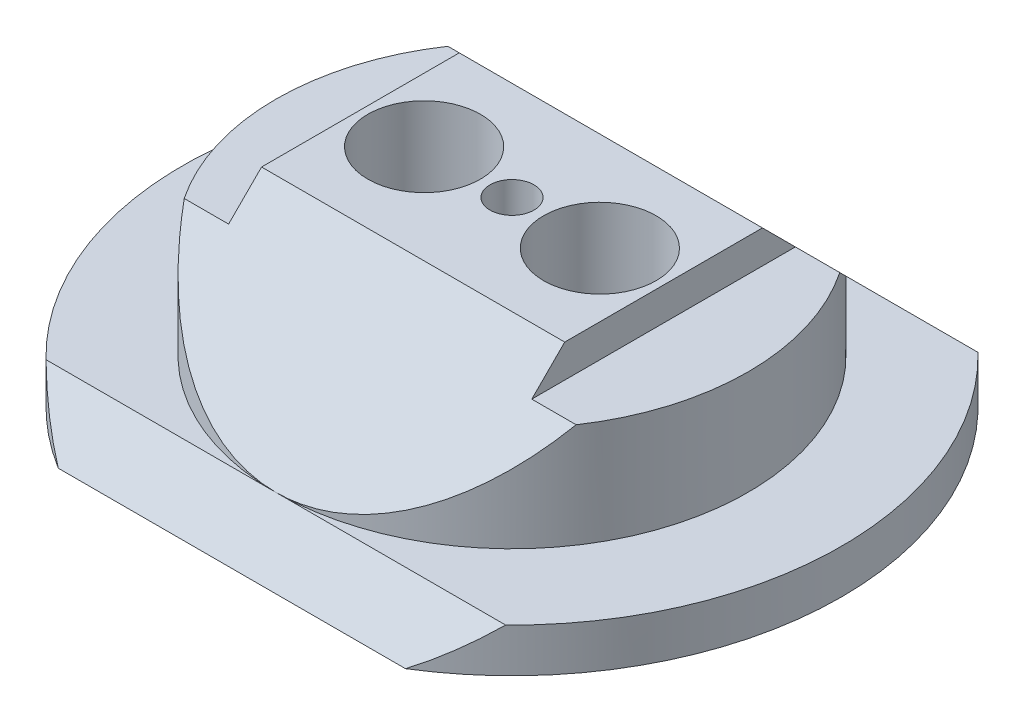
from build123d import *
from build123d.topology import SkipClean

# Parameters (mm, degrees)
SKETCH1_R                            = 30
BOSS_EXTRUDE1_DEPTH                  = 4
BOSS_EXTRUDE2_REACH                  = 44.615
BOSS_EXTRUDE2_END_RADIUS             = 30
BOSS_EXTRUDE2_DIRECTION_2_REACH      = 44.615
BOSS_EXTRUDE2_DIRECTION_2_END_RADIUS = 30
SKETCH3_OUTSIDE_W                    = 78.092
SKETCH3_OUTSIDE_H                    = 69.092
SKETCH3_OUTSIDE_R                    = 21.5
CUT_EXTRUDE2_DEPTH                   = 12.5
BOSS_EXTRUDE3_DEPTH                  = 18
BOSS_EXTRUDE4_DEPTH                  = 15
BOSS_EXTRUDE5_DEPTH                  = 15
CUT_EXTRUDE3_DEPTH                   = 44.292609069
CUT_EXTRUDE3_DEPTH_BACK              = 44.292609069
SKETCH8_R                            = 2
CUT_EXTRUDE8_DEPTH                   = 48.077064479
CUT_EXTRUDE8_DEPTH_BACK              = 48.077064479
CUT_EXTRUDE9_DEPTH                   = 59.659818207
CUT_EXTRUDE11_DEPTH                  = 20
CUT_EXTRUDE12_DEPTH                  = 20
CUT_EXTRUDE13_DEPTH                  = 20
CUT_EXTRUDE14_DEPTH                  = 44.292609069
CUT_EXTRUDE14_DEPTH_BACK             = 44.292609069
SKETCH25_W                           = 66.075437062
SKETCH25_H                           = 20.142243048
SKETCH26_R                           = 5.125
CUT_EXTRUDE15_DEPTH                  = 24
CUT_EXTRUDE17_DEPTH                  = 47.524187258
CUT_EXTRUDE17_DEPTH_BACK             = 47.524187258
SKETCH29_W                           = 7.7
SKETCH29_H                           = 3
CUT_EXTRUDE18_DEPTH                  = 47.524187258
CUT_EXTRUDE18_DEPTH_BACK             = 47.524187258
SKETCH31_W                           = 7.7
SKETCH31_H                           = 3
SKETCH34_R                           = 1.375
CUT_EXTRUDE21_DEPTH                  = 20
SKETCH35_R                           = 2
CUT_EXTRUDE22_DEPTH                  = 6
SKETCH37_R                           = 5
CUT_EXTRUDE23_DEPTH                  = 3


with BuildPart() as part:
    # Sketch1 → Boss-Extrude1 (new body)
    with BuildSketch(Plane(origin=(0, 0, 0), x_dir=(1, 0, 0), z_dir=(0, 1, 0))):
        with Locations(Location((0, 0, 0), (0, 0, 270))):
            Circle(SKETCH1_R)
    extrude(amount=BOSS_EXTRUDE1_DEPTH)

    # Boss-Extrude2: up to this cylinder (the profile starts inside it)
    with SkipClean():  # the faces are left unmerged after this step: merging them gives an invalid solid
        boss_extrude2_end = Plane(origin=(0, 9.396175, 0), z_dir=(0, -1, 0)) * Cylinder(BOSS_EXTRUDE2_END_RADIUS, 150.23, mode=Mode.PRIVATE)
        # Sketch2 → Boss-Extrude2 (add, up to the surface)
        with BuildSketch(Plane(origin=(0, 0, 0), x_dir=(0, 0, -1), z_dir=(1, 0, 0)), mode=Mode.PRIVATE) as boss_extrude2_sk1:
            Polygon((0, 4), (21.5, 4), (9, 16.5), (-9, 16.5), (-21.5, 4), align=None)
        boss_extrude2_tool1 = extrude(boss_extrude2_sk1.sketch, amount=BOSS_EXTRUDE2_REACH, mode=Mode.PRIVATE) & boss_extrude2_end
        add(boss_extrude2_tool1.solids().sort_by_distance((0, 9.396175, 0))[0])

    # Boss-Extrude2 direction 2: up to this cylinder (the profile starts inside it)
    with SkipClean():  # the faces are left unmerged after this step: merging them gives an invalid solid
        boss_extrude2_direction_2_end = Plane(origin=(0, 9.396175, 0), z_dir=(0, -1, 0)) * Cylinder(BOSS_EXTRUDE2_DIRECTION_2_END_RADIUS, 150.23, mode=Mode.PRIVATE)
        # Sketch2 → Boss-Extrude2 direction 2 (add, up to the surface)
        with BuildSketch(Plane(origin=(0, 0, 0), x_dir=(0, 0, -1), z_dir=(1, 0, 0)), mode=Mode.PRIVATE) as boss_extrude2_direction_2_sk1:
            Polygon((0, 4), (21.5, 4), (9, 16.5), (-9, 16.5), (-21.5, 4), align=None)
        boss_extrude2_direction_2_tool1 = extrude(boss_extrude2_direction_2_sk1.sketch, amount=-BOSS_EXTRUDE2_DIRECTION_2_REACH, mode=Mode.PRIVATE) & boss_extrude2_direction_2_end
        add(boss_extrude2_direction_2_tool1.solids().sort_by_distance((0, 9.396175, 0))[0])

    # SurfaceCut1
    split(bisect_by=Plane(origin=(0, 12.75, -12.75), x_dir=(1, 0, 0), z_dir=(0, 0.7071067811865558, -0.7071067811865392)), keep=Keep.BOTTOM)

    # SurfaceCut2
    split(bisect_by=Plane(origin=(0, 12.75, 12.75), x_dir=(1, 0, 0), z_dir=(0, 0.7071067811865509, 0.7071067811865442)), keep=Keep.BOTTOM)

    # Sketch3 outside → Cut-Extrude2 (cut)
    with BuildSketch(Plane(origin=(0, 4, 0), x_dir=(1, 0, 0), z_dir=(0, 1, 0))):
        Rectangle(SKETCH3_OUTSIDE_W, SKETCH3_OUTSIDE_H)
        Circle(SKETCH3_OUTSIDE_R, mode=Mode.SUBTRACT)
    extrude(amount=CUT_EXTRUDE2_DEPTH, mode=Mode.SUBTRACT)

    # Sketch5 → Boss-Extrude3 (add)
    with BuildSketch(Plane(origin=(0, 0, 0), x_dir=(-1, 0, 0), z_dir=(0, -1, 0))):
        Polygon((0, -6), (-17.5, -6), (-17.5, 6), (17.5, 6), (17.5, -6), align=None)
    extrude(amount=BOSS_EXTRUDE3_DEPTH)

    # Sketch6 → Boss-Extrude4 (add)
    with BuildSketch(Plane.XZ):
        Polygon((0, 15), (7, 15), (7, 6), (-7, 6), (-7, 15), align=None)
    extrude(amount=BOSS_EXTRUDE4_DEPTH)

    # Sketch7 → Boss-Extrude5 (add)
    with BuildSketch(Plane.XZ):
        Polygon((0, -15), (7, -15), (7, -6), (-7, -6), (-7, -15), align=None)
    extrude(amount=BOSS_EXTRUDE5_DEPTH)

    # Sketch8 → Cut-Extrude3 (cut, two sides: drawn at the far end of the back side and taken through both)
    with BuildSketch(Plane.XY.offset(-CUT_EXTRUDE3_DEPTH_BACK)):
        with Locations((-12.5, -12.5)):
            Circle(SKETCH8_R)
        with Locations((12.5, -12.5)):
            Circle(SKETCH8_R)
    extrude(amount=CUT_EXTRUDE3_DEPTH + CUT_EXTRUDE3_DEPTH_BACK, mode=Mode.SUBTRACT)

    # Sketch16 → Cut-Extrude8 (cut, two sides: drawn at the far end of the back side and taken through both)
    with BuildSketch(Plane.XY.offset(6).offset(-CUT_EXTRUDE8_DEPTH_BACK)):
        Polygon((17.5, -18), (17.5, -14.5), (14, -18), align=None)
        Polygon((-17.5, -18), (-14, -18), (-17.5, -14.5), align=None)
    extrude(amount=CUT_EXTRUDE8_DEPTH + CUT_EXTRUDE8_DEPTH_BACK, mode=Mode.SUBTRACT)

    # Sketch17 → Cut-Extrude9 (cut, through all)
    with BuildSketch(Plane(origin=(10.365975269, -9.674910251, -8.062425209), x_dir=(-0.3613483622370374, 0.337258471421235, -0.8693009171531012), z_dir=(0.6355070151731325, -0.5931398808282571, -0.49428323402354774))):
        Polygon((-2.372510104, -6.189601271), (7.980636686, -0.706686759), (7.980636686, -10.965829024), align=None)
    extrude(amount=CUT_EXTRUDE9_DEPTH, mode=Mode.SUBTRACT)

    # Sketch19 → Cut-Extrude11 (cut)
    with BuildSketch(Plane(origin=(-10.365975269, -9.674910251, -8.062425209), x_dir=(0.3613483622370374, 0.33725847142123494, -0.8693009171531012), z_dir=(0.6355070151731324, 0.5931398808282571, 0.4942832340235476))):
        Polygon((-2.372510104, -6.189601271), (7.980636686, -10.965829024), (7.980636686, -0.706686759), align=None)
    extrude(amount=-CUT_EXTRUDE11_DEPTH, mode=Mode.SUBTRACT)

    # Sketch20 → Cut-Extrude12 (cut)
    with BuildSketch(Plane(origin=(-10.365975269, -9.674910251, 8.062425209), x_dir=(-0.3613483622370374, -0.3372584714212349, -0.8693009171531013), z_dir=(0.6355070151731326, 0.593139880828257, -0.49428323402354757))):
        Polygon((2.372510104, -6.189601271), (-7.980636686, -0.706686759), (-7.980636686, -10.965829024), align=None)
    extrude(amount=-CUT_EXTRUDE12_DEPTH, mode=Mode.SUBTRACT)

    # Sketch21 → Cut-Extrude13 (cut)
    with BuildSketch(Plane(origin=(10.365975269, -9.674910251, 8.062425209), x_dir=(-0.3613483622370374, 0.3372584714212349, 0.8693009171531013), z_dir=(-0.6355070151731326, 0.593139880828257, -0.49428323402354757))):
        Polygon((-2.372510104, -6.189601271), (7.980636686, -0.706686759), (7.980636686, -10.965829024), align=None)
    extrude(amount=-CUT_EXTRUDE13_DEPTH, mode=Mode.SUBTRACT)

    # Sketch25 → Cut-Extrude14 (cut, two sides: drawn at the far end of the back side and taken through both)
    with BuildSketch(Plane.XY.offset(-CUT_EXTRUDE14_DEPTH_BACK)):
        with Locations((0, -10.071121524)):
            Rectangle(SKETCH25_W, SKETCH25_H)
    extrude(amount=CUT_EXTRUDE14_DEPTH + CUT_EXTRUDE14_DEPTH_BACK, mode=Mode.SUBTRACT)

    # Sketch26 → Cut-Extrude15 (cut)
    with BuildSketch(Plane(origin=(0, 16.5, 0), x_dir=(1, 0, 0), z_dir=(0, 1, 0))):
        with Locations(Location((-8, 0, 0), (0, 0, 270))):
            Circle(SKETCH26_R)
        with Locations(Location((8, 0, 0), (0, 0, 270))):
            Circle(SKETCH26_R)
    extrude(amount=-CUT_EXTRUDE15_DEPTH, mode=Mode.SUBTRACT)

    # Sketch29 → Cut-Extrude17 (cut, two sides: drawn at the far end of the back side and taken through both)
    with BuildSketch(Plane.XY.offset(6).offset(-CUT_EXTRUDE17_DEPTH_BACK)):
        with Locations((17.65, 15)):
            Rectangle(SKETCH29_W, SKETCH29_H)
    extrude(amount=CUT_EXTRUDE17_DEPTH + CUT_EXTRUDE17_DEPTH_BACK, mode=Mode.SUBTRACT)

    # Sketch31 → Cut-Extrude18 (cut, two sides: drawn at the far end of the back side and taken through both)
    with BuildSketch(Plane.XY.offset(6).offset(-CUT_EXTRUDE18_DEPTH_BACK)):
        with Locations((-17.65, 15)):
            Rectangle(SKETCH31_W, SKETCH31_H)
    extrude(amount=CUT_EXTRUDE18_DEPTH + CUT_EXTRUDE18_DEPTH_BACK, mode=Mode.SUBTRACT)

    # Sketch34 → Cut-Extrude21 (cut)
    with BuildSketch(Plane.XZ):
        with Locations(Location((0, 0, 0), (0, 0, 270))):
            Circle(SKETCH34_R)
    extrude(amount=-CUT_EXTRUDE21_DEPTH, mode=Mode.SUBTRACT)

    # Sketch35 → Cut-Extrude22 (cut)
    with BuildSketch(Plane(origin=(0, 16.5, 0), x_dir=(1, 0, 0), z_dir=(0, 1, 0))):
        with Locations(Location((0, 0, 0), (0, 0, 270))):
            Circle(SKETCH35_R)
    extrude(amount=-CUT_EXTRUDE22_DEPTH, mode=Mode.SUBTRACT)

    # Sketch37 → Cut-Extrude23 (cut)
    with BuildSketch(Plane.XZ):
        with Locations(Location((0, -15, 0), (0, 0, 270))):
            Circle(SKETCH37_R)
        with Locations(Location((0, 15, 0), (0, 0, 270))):
            Circle(SKETCH37_R)
        with Locations(Location((-22, 0, 0), (0, 0, 270))):
            Circle(SKETCH37_R)
        with Locations(Location((22, 0, 0), (0, 0, 270))):
            Circle(SKETCH37_R)
        with Locations(Location((-14, 12, 0), (0, 0, 270))):
            Circle(SKETCH37_R)
        with Locations(Location((14, 12, 0), (0, 0, 270))):
            Circle(SKETCH37_R)
        with Locations(Location((-14, -12, 0), (0, 0, 270))):
            Circle(SKETCH37_R)
        with Locations(Location((14, -12, 0), (0, 0, 270))):
            Circle(SKETCH37_R)
    extrude(amount=-CUT_EXTRUDE23_DEPTH, mode=Mode.SUBTRACT)


solid = part.part
